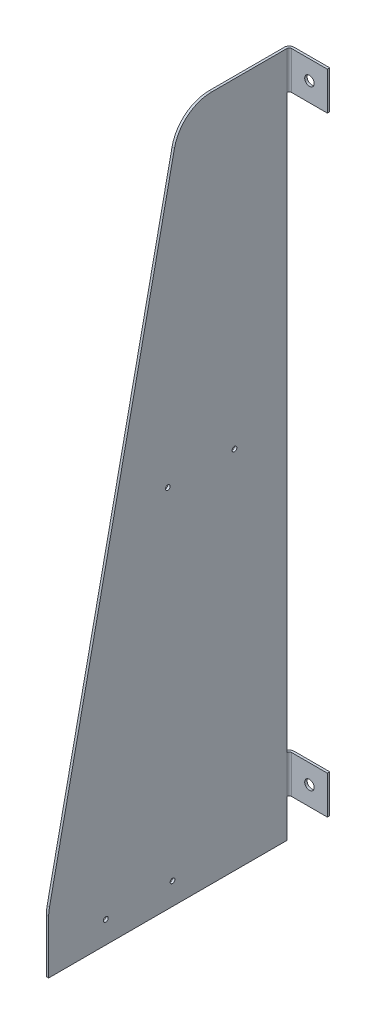
from build123d import *

# Parameters (mm, degrees)
BOSS_EXTRUDE2_DEPTH        = 3.175
SKETCH2_W                  = 3.175
SKETCH2_H                  = 50.8
BOSS_EXTRUDE3_DEPTH        = 50.8
FILLET1_R                  = 3.175
FILLET2_R                  = 6.35
F_1_2_0_5_DIAMETER_HOLE1_D = 12.7


with BuildPart() as part:
    # Sketch1 → Boss-Extrude2 (new body)
    with BuildSketch(Plane(origin=(0, 0, 0), x_dir=(0, 0, -1), z_dir=(1, 0, 0))):
        with BuildLine():
            Line((-317.5, 0), (0, 0))
            Line((0, 0), (0, 50.8))
            Line((0, 50.8), (6.35, 50.8))
            Line((6.35, 50.8), (6.35, 101.6))
            Line((6.35, 101.6), (0, 101.6))
            Line((0, 101.6), (0, 559.756235294))
            Line((0, 559.756235294), (0, 863.6))
            Line((0, 863.6), (6.35, 863.6))
            Line((6.35, 863.6), (6.35, 914.4))
            Line((6.35, 914.4), (-100.150182785, 914.4))
            ThreePointArc((-100.150182785, 914.4), (-132.16586597, 903.041552077), (-149.864680249, 874.045513001))
            Line((-149.864680249, 874.045513001), (-316.414497465, 81.366353538))
            ThreePointArc((-316.414497465, 81.366353538), (-317.227895618, 76.171722787), (-317.5, 70.920840537))
            Line((-317.5, 70.920840537), (-317.5, 0))
        make_face()
        with BuildLine():
            ThreePointArc((-244.475, 29.604131036), (-241.3, 32.779131036), (-238.125, 29.604131036))
            ThreePointArc((-238.125, 29.604131036), (-241.3, 26.429131036), (-244.475, 29.604131036))
        make_face(mode=Mode.SUBTRACT)
        with BuildLine():
            ThreePointArc((-149.225, 29.604131036), (-152.4, 26.429131036), (-155.575, 29.604131036))
            ThreePointArc((-155.575, 29.604131036), (-152.4, 32.779131036), (-149.225, 29.604131036))
        make_face(mode=Mode.SUBTRACT)
        with BuildLine():
            ThreePointArc((-161.925, 486.804131036), (-158.75, 489.979131036), (-155.575, 486.804131036))
            ThreePointArc((-155.575, 486.804131036), (-158.75, 483.629131036), (-161.925, 486.804131036))
        make_face(mode=Mode.SUBTRACT)
        with BuildLine():
            ThreePointArc((-66.675, 486.804131036), (-69.85, 483.629131036), (-73.025, 486.804131036))
            ThreePointArc((-73.025, 486.804131036), (-69.85, 489.979131036), (-66.675, 486.804131036))
        make_face(mode=Mode.SUBTRACT)
    extrude(amount=BOSS_EXTRUDE2_DEPTH)

    # Sketch2 → Boss-Extrude3 (add)
    with BuildSketch(Plane(origin=(3.175, 0, 0), x_dir=(0, 0, -1), z_dir=(1, 0, 0))):
        with Locations((4.7625, 889)):
            Rectangle(SKETCH2_W, SKETCH2_H)
        with Locations((4.7625, 76.2)):
            Rectangle(SKETCH2_W, SKETCH2_H)
    extrude(amount=BOSS_EXTRUDE3_DEPTH)

    # Fillet1
    fillet1_edges = [part.edges().sort_by_distance(p)[0] for p in [
        (3.175, 889, -3.175),
        (3.175, 76.2, -3.175),
    ]]
    fillet(fillet1_edges, radius=FILLET1_R)

    # Fillet2
    fillet2_edges = [part.edges().sort_by_distance(p)[0] for p in [
        (0, 76.2, -6.35),
        (0, 889, -6.35),
    ]]
    fillet(fillet2_edges, radius=FILLET2_R)

    # 1/2 (0.5) Diameter Hole1 (through all)
    with Locations(Plane.XY.offset(-3.175)):
        with Locations((30.1625, 76.2), (30.1625, 889)):
            Hole(F_1_2_0_5_DIAMETER_HOLE1_D / 2)


solid = part.part
